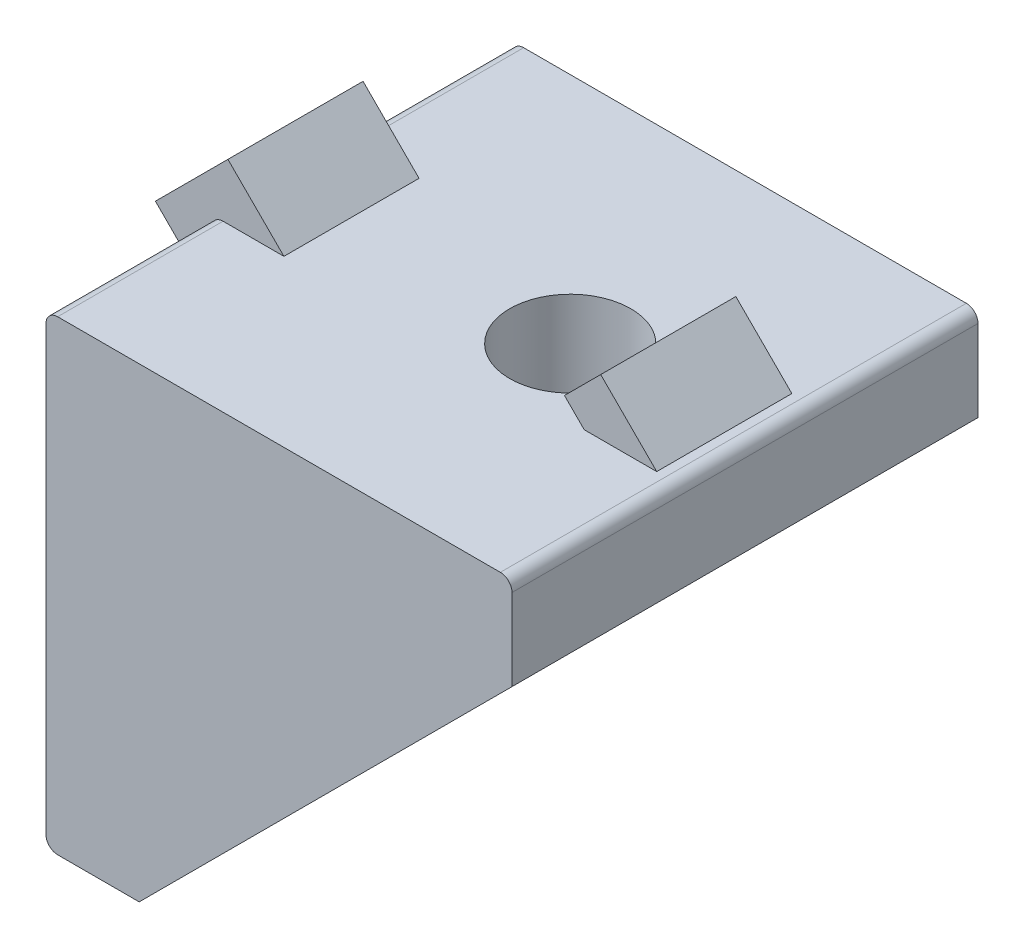
from build123d import *

# Parameters (mm, degrees)
EXTRUDE_1_DEPTH     = 10
EXTRUDE_2_DEPTH     = 3
SKETCH_3_R          = 2.6
CUT_EXTRUDE_1_DEPTH = 25.738633754
SKETCH_4_R          = 2.6
CUT_EXTRUDE_2_DEPTH = 25.738633754
EXTRUDE_START       = -10
EXTRUDE_3_DEPTH     = 2.9
FILLET_1_R          = 0.5
CHAMFER_1_SIZE      = 1


with BuildPart() as part:
    # Эскиз1 → Бобышка-Вытянуть1 (new, symmetric)
    with BuildSketch(Plane.XY):
        Polygon((0, 0), (0, -16), (-4, -16), (-4, 4), (16, 4), (16, 0), align=None)
    extrude(amount=EXTRUDE_1_DEPTH, both=True)

    # Эскиз2 → Бобышка-Вытянуть2 (add)
    with BuildSketch(Plane.XY.offset(10)):
        Polygon((0, -16), (0, 0), (16, 0), align=None)
    extrude_2 = extrude(amount=-EXTRUDE_2_DEPTH)

    # Зеркальное отражение1: Бобышка-Вытянуть2 across plane
    add(extrude_2.mirror(Plane.XY))

    # Эскиз3 → Вырез-Вытянуть1 (cut, through all)
    with BuildSketch(Plane(origin=(0, 0, 0), x_dir=(0, 0, -1), z_dir=(1, 0, 0))):
        with Locations((0, -8.5)):
            Circle(SKETCH_3_R)
        with Locations((20, -8.5)):
            Circle(SKETCH_3_R)
        with Locations((20, 11.5)):
            Circle(SKETCH_3_R)
        with Locations((0, 11.5)):
            Circle(SKETCH_3_R)
    extrude(amount=-CUT_EXTRUDE_1_DEPTH, mode=Mode.SUBTRACT)

    # Эскиз4 → Вырез-Вытянуть2 (cut, through all)
    with BuildSketch(Plane.XZ):
        with Locations((8.5, 0)):
            Circle(SKETCH_4_R)
        with Locations((-11.5, 0)):
            Circle(SKETCH_4_R)
        with Locations((-11.5, 20)):
            Circle(SKETCH_4_R)
        with Locations((8.5, 20)):
            Circle(SKETCH_4_R)
    extrude(amount=-CUT_EXTRUDE_2_DEPTH, mode=Mode.SUBTRACT)

    # Эскиз5 → Бобышка-Вытянуть3 (add, symmetric)
    with BuildSketch(Plane.XY.offset(10).offset(EXTRUDE_START)):
        Polygon((-0.888730163, 4), (-3.292893219, 6.404163056), (-6.404163056, 3.292893219), (-4, 0.888730163), (-4, 4), align=None)
        Polygon((16, 3.111269837), (12.707106781, 6.404163056), (11.151471863, 4.848528137), (16, 0), align=None)
        Polygon((-4.848528137, -11.151471863), (0, -16), (-3.111269837, -16), (-6.404163056, -12.707106781), align=None)
    extrude(amount=EXTRUDE_3_DEPTH, both=True)

    # Скругление1
    fillet_1_edges = [part.edges().sort_by_distance(p)[0] for p in [
        (-4, -16, 0),
        (-4, 4, 6.45),
        (16, 4, 0),
        (-4, 4, -6.45),
    ]]
    fillet(fillet_1_edges, radius=FILLET_1_R)

    # Фаска1
    chamfer_1_edges = [part.edges().sort_by_distance(p)[0] for p in [
        (0, 0, 0),
        (0, -8, 7),
        (8, 0, 7),
        (8, 0, -7),
        (0, -8, -7),
    ]]
    chamfer(chamfer_1_edges, length=CHAMFER_1_SIZE)


solid = part.part
